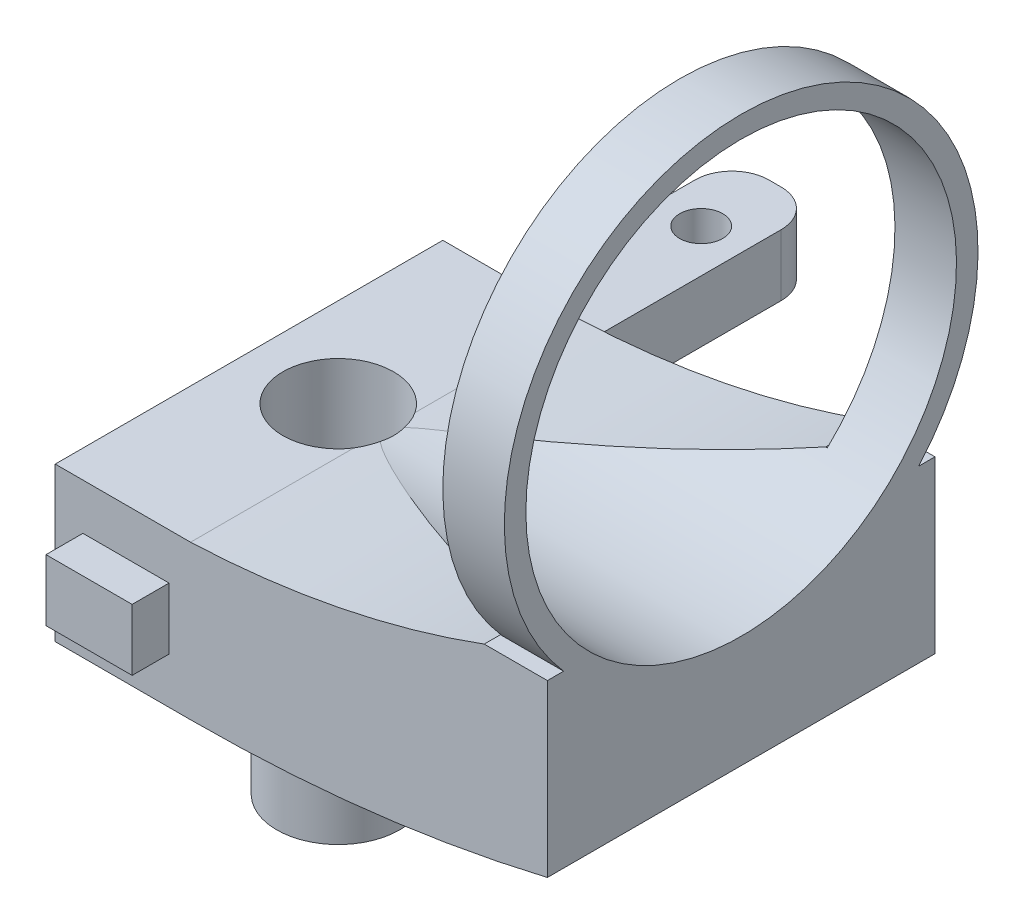
from build123d import *

# Parameters (mm, degrees)
BOSS_EXTRUDE1_DEPTH      = 48
SKETCH2_W                = 14
SKETCH2_H                = 10
BOSS_EXTRUDE2_DEPTH      = 50
FILLET1_R                = 6
SKETCH7_R                = 38.5
SKETCH7_R_2              = 35
BOSS_EXTRUDE3_DEPTH      = 10
SKETCH8_R                = 35
CUT_EXTRUDE2_DEPTH       = 90
BOSS_EXTRUDE4_DEPTH      = 5
BOSS_EXTRUDE4_DEPTH_BACK = 10
SKETCH10_R               = 12
SKETCH10_R_2             = 9
BOSS_EXTRUDE5_START      = 25
SKETCH11_R               = 10
SKETCH11_R_2             = 9
BOSS_EXTRUDE5_DEPTH      = 25
SKETCH12_R               = 9
CUT_EXTRUDE3_DEPTH       = 42
BOSS_EXTRUDE6_DEPTH      = 7.5
BOSS_EXTRUDE7_START      = 7.5
BOSS_EXTRUDE7_DEPTH      = 7.5
FILLET1_OF_MIRROR1_R     = 6
SKETCH15_W               = 14
SKETCH15_H               = 10
CUT_EXTRUDE4_DEPTH       = 101


with BuildPart() as part:
    # Sketch1 → Boss-Extrude1 (new body)
    with BuildSketch(Plane.XY):
        with BuildLine():
            Line((0, 0), (0, 25.00039893))
            Line((0, 25.00039893), (22, 25.00039893))
            ThreePointArc((22, 25.00039893), (51.667114877, 29.062120939), (80, 38.751440389))
            Line((80, 38.751440389), (80, 6.798665084))
            ThreePointArc((80, 6.798665084), (51.198552391, 1.705464917), (22, 0))
            Line((22, 0), (0, 0))
        make_face()
    extrude(amount=BOSS_EXTRUDE1_DEPTH)

    # Sketch2 → Boss-Extrude2 (add)
    with BuildSketch(Plane.XY.offset(48)):
        with Locations((11.5, 12.5)):
            Rectangle(SKETCH2_W, SKETCH2_H)
    boss_extrude2 = extrude(amount=BOSS_EXTRUDE2_DEPTH)

    # Sketch5 → M8x1.0 Tapped Hole1 (revolve, cut)
    with BuildSketch(Plane(origin=(11.5, 17.5, 86), x_dir=(0, 0, 1), z_dir=(1, 0, 0))):
        Polygon((0, 0), (0, 12.103012167), (3.5, 10), (3.5, 0), align=None)
    m8x1_0_tapped_hole1 = revolve(axis=Axis((11.5, 23.85, 86), (0, -1, 0)), mode=Mode.SUBTRACT)

    # Fillet1
    fillet1_edges = [part.edges().sort_by_distance(p)[0] for p in [
        (18.5, 12.5, 98),
        (4.5, 12.5, 98),
    ]]
    fillet(fillet1_edges, radius=FILLET1_R)

    # Sketch7 → Boss-Extrude3 (add)
    with BuildSketch(Plane.ZY.offset(-80)):
        with Locations((24, 60.00039893)):
            Circle(SKETCH7_R)
        with Locations((24, 60.00039893)):
            Circle(SKETCH7_R_2, mode=Mode.SUBTRACT)
    extrude(amount=BOSS_EXTRUDE3_DEPTH)

    # Sketch8 → Cut-Extrude2 (cut)
    with BuildSketch(Plane.ZY.offset(-80)):
        with Locations(Location((24, 60.00039893, 0), (0, 0, 226.708192407))):
            Circle(SKETCH8_R)
    extrude(amount=CUT_EXTRUDE2_DEPTH, mode=Mode.SUBTRACT)

    # Sketch10 → Boss-Extrude4 (add, two sides: drawn at the far end of the back side and taken through both)
    with BuildSketch(Plane.XZ.offset(-BOSS_EXTRUDE4_DEPTH_BACK)):
        with Locations((14.5, 24)):
            Circle(SKETCH10_R)
        with Locations((14.5, 24)):
            Circle(SKETCH10_R_2, mode=Mode.SUBTRACT)
    extrude(amount=BOSS_EXTRUDE4_DEPTH + BOSS_EXTRUDE4_DEPTH_BACK)

    # Sketch11 → Boss-Extrude5 (add)
    with BuildSketch(Plane.XZ.offset(5).offset(BOSS_EXTRUDE5_START)):
        with Locations((14.5, 24)):
            Circle(SKETCH11_R)
        with Locations((14.5, 24)):
            Circle(SKETCH11_R_2, mode=Mode.SUBTRACT)
    extrude(amount=-BOSS_EXTRUDE5_DEPTH)

    # Sketch12 → Cut-Extrude3 (cut)
    with BuildSketch(Plane(origin=(0, 0, 0), x_dir=(-1, 0, 0), z_dir=(0, -1, 0))):
        with Locations(Location((-14.5, -24, 0), (0, 0, 180))):
            Circle(SKETCH12_R)
    extrude(amount=-CUT_EXTRUDE3_DEPTH, mode=Mode.SUBTRACT)

    # Sketch13 → Boss-Extrude6 (add)
    with BuildSketch(Plane.XY.offset(48)):
        with BuildLine():
            Line((0, 25.00039893), (0, 0))
            Line((0, 0), (22, 0))
            ThreePointArc((22, 0), (51.198552391, 1.705464917), (80, 6.798665084))
            Line((80, 6.798665084), (80, 29.896412483))
            Line((80, 29.896412483), (80, 34.524920524))
            Line((80, 34.524920524), (70, 34.524920524))
            Line((70, 34.524920524), (69.729925021, 34.524920524))
            ThreePointArc((69.729925021, 34.524920524), (46.24106465, 27.877911315), (22, 25.00039893))
            Line((22, 25.00039893), (0, 25.00039893))
        make_face()
    extrude(amount=BOSS_EXTRUDE6_DEPTH)

    # Sketch14 → Boss-Extrude7 (add)
    with BuildSketch(Plane(origin=(0, 0, 0), x_dir=(-1, 0, 0), z_dir=(0, 0, -1)).offset(BOSS_EXTRUDE7_START)):
        with BuildLine():
            Line((-80, 29.896412483), (-80, 6.798665084))
            ThreePointArc((-80, 6.798665084), (-51.198552391, 1.705464917), (-22, 0))
            Line((-22, 0), (0, 0))
            Line((0, 0), (0, 25.00039893))
            Line((0, 25.00039893), (-22, 25.00039893))
            ThreePointArc((-22, 25.00039893), (-46.24106465, 27.877911315), (-69.729925021, 34.524920524))
            Line((-69.729925021, 34.524920524), (-70, 34.524920524))
            Line((-70, 34.524920524), (-80, 34.524920524))
            Line((-80, 34.524920524), (-80, 29.896412483))
        make_face()
    extrude(amount=-BOSS_EXTRUDE7_DEPTH)

    # Mirror1: Boss-Extrude2, M8x1.0 Tapped Hole1 across plane
    add(boss_extrude2.mirror(Plane.XY.offset(24)))
    add(m8x1_0_tapped_hole1.mirror(Plane.XY.offset(24)), mode=Mode.SUBTRACT)

    # Fillet1 of Mirror1
    fillet1_of_mirror1_edges = [part.edges().sort_by_distance(p)[0] for p in [
        (18.5, 12.5, -50),
        (4.5, 12.5, -50),
    ]]
    fillet(fillet1_of_mirror1_edges, radius=FILLET1_OF_MIRROR1_R)

    # Sketch15 → Cut-Extrude4 (cut)
    with BuildSketch(Plane.XY.offset(61.5)):
        with Locations((11.5, 12.5)):
            Rectangle(SKETCH15_W, SKETCH15_H)
    extrude(amount=CUT_EXTRUDE4_DEPTH, mode=Mode.SUBTRACT)


solid = part.part
